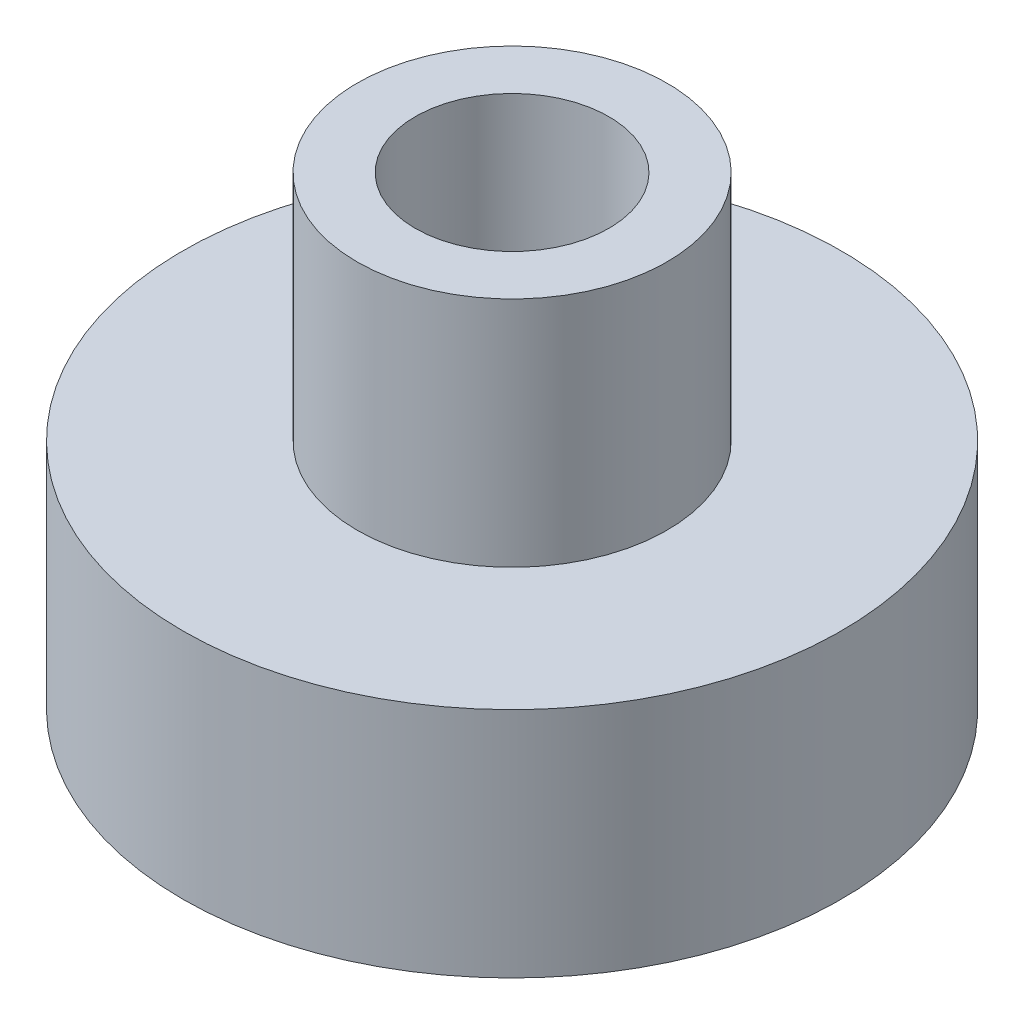
from build123d import *

# Parameters (mm, degrees)
ESQUISSE1_R             = 8.5
BOSS_EXTRU_1_DEPTH      = 6
ESQUISSE2_R             = 4
BOSS_EXTRU_2_DEPTH      = 6
ENL_V_MAT_EXTRU_1_REACH = 18.985
ESQUISSE3_R             = 2.5


with BuildPart() as part:
    # Esquisse1 → Boss.-Extru.1 (new body)
    with BuildSketch(Plane(origin=(0, 0, 0), x_dir=(1, 0, 0), z_dir=(0, 1, 0))):
        with Locations(Location((0, 0, 0), (0, 0, 270))):
            Circle(ESQUISSE1_R)
    extrude(amount=BOSS_EXTRU_1_DEPTH)

    # Esquisse2 → Boss.-Extru.2 (add)
    with BuildSketch(Plane(origin=(0, 6, 0), x_dir=(1, 0, 0), z_dir=(0, 1, 0))):
        with Locations(Location((0, 0, 0), (0, 0, 270))):
            Circle(ESQUISSE2_R)
    extrude(amount=BOSS_EXTRU_2_DEPTH)

    # Esquisse3 → Enlèv. mat.-Extru.1 (cut, up to next)
    with BuildSketch(Plane(origin=(0, 12, 0), x_dir=(1, 0, 0), z_dir=(0, 1, 0)), mode=Mode.PRIVATE) as enl_v_mat_extru_1_sk1:
        with Locations(Location((0, 0, 0), (0, 0, 270))):
            Circle(ESQUISSE3_R)
    enl_v_mat_extru_1_tool1 = extrude(enl_v_mat_extru_1_sk1.sketch, amount=-ENL_V_MAT_EXTRU_1_REACH, mode=Mode.PRIVATE) & part.part
    add(enl_v_mat_extru_1_tool1.solids().sort_by_distance((0, 12, 0))[0], mode=Mode.SUBTRACT)


solid = part.part
